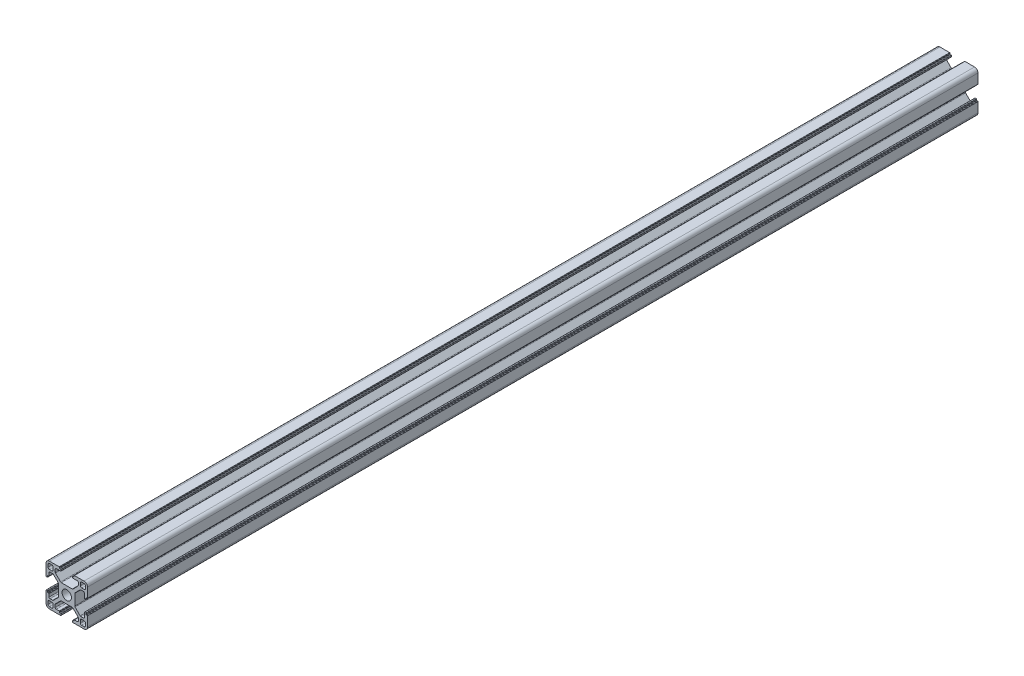
from build123d import *

# Parameters (mm, degrees)
SKETCH1_R           = 3.4
BOSS_EXTRUDE1_DEPTH = 644


with BuildPart() as part:
    # Sketch1 → Boss-Extrude1 (new body)
    with BuildSketch(Plane.XY):
        with BuildLine():
            Line((0, 2.5), (0, 10.6))
            ThreePointArc((0, 10.6), (0.058578644, 10.741421356), (0.2, 10.8))
            Line((0.2, 10.8), (1, 10.8))
            ThreePointArc((1, 10.8), (1.141421356, 10.741421356), (1.2, 10.6))
            Line((1.2, 10.6), (1.2, 9.9))
            ThreePointArc((1.2, 9.9), (1.258578644, 9.758578644), (1.4, 9.7))
            Line((1.4, 9.7), (2, 9.7))
            ThreePointArc((2, 9.7), (2.141421356, 9.641421356), (2.2, 9.5))
            Line((2.2, 9.5), (2.2, 7.4))
            ThreePointArc((2.2, 7.4), (2.419669914, 6.869669914), (2.95, 6.65))
            Line((2.95, 6.65), (4.78370491, 6.65))
            ThreePointArc((4.78370491, 6.65), (5.070717484, 6.707090351), (5.314034995, 6.869669914))
            Line((5.314034995, 6.869669914), (8.980330086, 10.535965005))
            ThreePointArc((8.980330086, 10.535965005), (9.142909649, 10.779282516), (9.2, 11.06629509))
            Line((9.2, 11.06629509), (9.2, 18.93370491))
            ThreePointArc((9.2, 18.93370491), (9.142909649, 19.220717484), (8.980330086, 19.464034995))
            Line((8.980330086, 19.464034995), (5.314034995, 23.130330086))
            ThreePointArc((5.314034995, 23.130330086), (5.070717484, 23.292909649), (4.78370491, 23.35))
            Line((4.78370491, 23.35), (2.95, 23.35))
            ThreePointArc((2.95, 23.35), (2.419669914, 23.130330086), (2.2, 22.6))
            Line((2.2, 22.6), (2.2, 20.5))
            ThreePointArc((2.2, 20.5), (2.141421356, 20.358578644), (2, 20.3))
            Line((2, 20.3), (1.4, 20.3))
            ThreePointArc((1.4, 20.3), (1.258578644, 20.241421356), (1.2, 20.1))
            Line((1.2, 20.1), (1.2, 19.4))
            ThreePointArc((1.2, 19.4), (1.141421356, 19.258578644), (1, 19.2))
            Line((1, 19.2), (0.2, 19.2))
            ThreePointArc((0.2, 19.2), (0.058578644, 19.258578644), (0, 19.4))
            Line((0, 19.4), (0, 27.5))
            ThreePointArc((0, 27.5), (0.732233047, 29.267766953), (2.5, 30))
            Line((2.5, 30), (9.5, 30))
            ThreePointArc((9.5, 30), (9.641421356, 29.941421356), (9.7, 29.8))
            Line((9.7, 29.8), (9.7, 29.2))
            ThreePointArc((9.7, 29.2), (9.758578644, 29.058578644), (9.9, 29))
            Line((9.9, 29), (10.6, 29))
            ThreePointArc((10.6, 29), (10.741421356, 28.941421356), (10.8, 28.8))
            Line((10.8, 28.8), (10.8, 28))
            ThreePointArc((10.8, 28), (10.741421356, 27.858578644), (10.6, 27.8))
            Line((10.6, 27.8), (7.4, 27.8))
            ThreePointArc((7.4, 27.8), (6.869669914, 27.580330086), (6.65, 27.05))
            Line((6.65, 27.05), (6.65, 25.21629509))
            ThreePointArc((6.65, 25.21629509), (6.707090351, 24.929282516), (6.869669914, 24.685965005))
            Line((6.869669914, 24.685965005), (10.535965005, 21.019669914))
            ThreePointArc((10.535965005, 21.019669914), (10.779282516, 20.857090351), (11.06629509, 20.8))
            Line((11.06629509, 20.8), (18.93370491, 20.8))
            ThreePointArc((18.93370491, 20.8), (19.220717484, 20.857090351), (19.464034995, 21.019669914))
            Line((19.464034995, 21.019669914), (23.130330086, 24.685965005))
            ThreePointArc((23.130330086, 24.685965005), (23.292909649, 24.929282516), (23.35, 25.21629509))
            Line((23.35, 25.21629509), (23.35, 27.05))
            ThreePointArc((23.35, 27.05), (23.130330086, 27.580330086), (22.6, 27.8))
            Line((22.6, 27.8), (19.4, 27.8))
            ThreePointArc((19.4, 27.8), (19.258578644, 27.858578644), (19.2, 28))
            Line((19.2, 28), (19.2, 28.8))
            ThreePointArc((19.2, 28.8), (19.258578644, 28.941421356), (19.4, 29))
            Line((19.4, 29), (20.1, 29))
            ThreePointArc((20.1, 29), (20.241421356, 29.058578644), (20.3, 29.2))
            Line((20.3, 29.2), (20.3, 29.8))
            ThreePointArc((20.3, 29.8), (20.358578644, 29.941421356), (20.5, 30))
            Line((20.5, 30), (27.5, 30))
            ThreePointArc((27.5, 30), (29.267766953, 29.267766953), (30, 27.5))
            Line((30, 27.5), (30, 20.5))
            ThreePointArc((30, 20.5), (29.941421356, 20.358578644), (29.8, 20.3))
            Line((29.8, 20.3), (29.2, 20.3))
            ThreePointArc((29.2, 20.3), (29.058578644, 20.241421356), (29, 20.1))
            Line((29, 20.1), (29, 19.4))
            ThreePointArc((29, 19.4), (28.941421356, 19.258578644), (28.8, 19.2))
            Line((28.8, 19.2), (28, 19.2))
            ThreePointArc((28, 19.2), (27.858578644, 19.258578644), (27.8, 19.4))
            Line((27.8, 19.4), (27.8, 22.6))
            ThreePointArc((27.8, 22.6), (27.580330086, 23.130330086), (27.05, 23.35))
            Line((27.05, 23.35), (25.21629509, 23.35))
            ThreePointArc((25.21629509, 23.35), (24.929282516, 23.292909649), (24.685965005, 23.130330086))
            Line((24.685965005, 23.130330086), (21.019669914, 19.464034995))
            ThreePointArc((21.019669914, 19.464034995), (20.857090351, 19.220717484), (20.8, 18.93370491))
            Line((20.8, 18.93370491), (20.8, 11.06629509))
            ThreePointArc((20.8, 11.06629509), (20.857090351, 10.779282516), (21.019669914, 10.535965005))
            Line((21.019669914, 10.535965005), (24.685965005, 6.869669914))
            ThreePointArc((24.685965005, 6.869669914), (24.929282516, 6.707090351), (25.21629509, 6.65))
            Line((25.21629509, 6.65), (27.05, 6.65))
            ThreePointArc((27.05, 6.65), (27.580330086, 6.869669914), (27.8, 7.4))
            Line((27.8, 7.4), (27.8, 10.6))
            ThreePointArc((27.8, 10.6), (27.858578644, 10.741421356), (28, 10.8))
            Line((28, 10.8), (28.8, 10.8))
            ThreePointArc((28.8, 10.8), (28.941421356, 10.741421356), (29, 10.6))
            Line((29, 10.6), (29, 9.9))
            ThreePointArc((29, 9.9), (29.058578644, 9.758578644), (29.2, 9.7))
            Line((29.2, 9.7), (29.8, 9.7))
            ThreePointArc((29.8, 9.7), (29.941421356, 9.641421356), (30, 9.5))
            Line((30, 9.5), (30, 2.5))
            ThreePointArc((30, 2.5), (29.267766953, 0.732233047), (27.5, 0))
            Line((27.5, 0), (19.4, 0))
            ThreePointArc((19.4, 0), (19.258578644, 0.058578644), (19.2, 0.2))
            Line((19.2, 0.2), (19.2, 1.132430858))
            ThreePointArc((19.2, 1.132430858), (19.258578644, 1.273852214), (19.4, 1.332430858))
            Line((19.4, 1.332430858), (20.1, 1.332430858))
            ThreePointArc((20.1, 1.332430858), (20.241421356, 1.391009502), (20.3, 1.532430858))
            Line((20.3, 1.532430858), (20.3, 2))
            ThreePointArc((20.3, 2), (20.358578644, 2.141421356), (20.5, 2.2))
            Line((20.5, 2.2), (22.6, 2.2))
            ThreePointArc((22.6, 2.2), (23.130330086, 2.419669914), (23.35, 2.95))
            Line((23.35, 2.95), (23.35, 4.916135768))
            ThreePointArc((23.35, 4.916135768), (23.292909649, 5.203148342), (23.130330086, 5.446465854))
            Line((23.130330086, 5.446465854), (19.464034995, 9.112760944))
            ThreePointArc((19.464034995, 9.112760944), (19.220717484, 9.275340508), (18.93370491, 9.332430858))
            Line((18.93370491, 9.332430858), (11.06629509, 9.332430858))
            ThreePointArc((11.06629509, 9.332430858), (10.779282516, 9.275340508), (10.535965005, 9.112760944))
            Line((10.535965005, 9.112760944), (6.869669914, 5.446465854))
            ThreePointArc((6.869669914, 5.446465854), (6.707090351, 5.203148342), (6.65, 4.916135768))
            Line((6.65, 4.916135768), (6.65, 3.082430858))
            ThreePointArc((6.65, 3.082430858), (6.869669914, 2.552100772), (7.4, 2.332430858))
            Line((7.4, 2.332430858), (9.5, 2.332430858))
            ThreePointArc((9.5, 2.332430858), (9.641421356, 2.273852214), (9.7, 2.132430858))
            Line((9.7, 2.132430858), (9.7, 1.532430858))
            ThreePointArc((9.7, 1.532430858), (9.758578644, 1.391009502), (9.9, 1.332430858))
            Line((9.9, 1.332430858), (10.6, 1.332430858))
            ThreePointArc((10.6, 1.332430858), (10.741421356, 1.273852214), (10.8, 1.132430858))
            Line((10.8, 1.132430858), (10.8, 0.2))
            ThreePointArc((10.8, 0.2), (10.741421356, 0.058578644), (10.6, 0))
            Line((10.6, 0), (2.5, 0))
            ThreePointArc((2.5, 0), (0.732233047, 0.732233047), (0, 2.5))
        make_face()
        with Locations((15, 15)):
            Circle(SKETCH1_R, mode=Mode.SUBTRACT)
        with BuildLine():
            Line((27.55, 1.45), (25.8, 1.45))
            ThreePointArc((25.8, 1.45), (25.092893219, 1.742893219), (24.8, 2.45))
            Line((24.8, 2.45), (24.8, 4.2))
            ThreePointArc((24.8, 4.2), (25.092893219, 4.907106781), (25.8, 5.2))
            Line((25.8, 5.2), (27.55, 5.2))
            ThreePointArc((27.55, 5.2), (28.257106781, 4.907106781), (28.55, 4.2))
            Line((28.55, 4.2), (28.55, 2.45))
            ThreePointArc((28.55, 2.45), (28.257106781, 1.742893219), (27.55, 1.45))
        make_face(mode=Mode.SUBTRACT)
        with BuildLine():
            Line((24.8, 25.8), (24.8, 27.55))
            ThreePointArc((24.8, 27.55), (25.092893219, 28.257106781), (25.8, 28.55))
            Line((25.8, 28.55), (27.55, 28.55))
            ThreePointArc((27.55, 28.55), (28.257106781, 28.257106781), (28.55, 27.55))
            Line((28.55, 27.55), (28.55, 25.8))
            ThreePointArc((28.55, 25.8), (28.257106781, 25.092893219), (27.55, 24.8))
            Line((27.55, 24.8), (25.8, 24.8))
            ThreePointArc((25.8, 24.8), (25.092893219, 25.092893219), (24.8, 25.8))
        make_face(mode=Mode.SUBTRACT)
        with BuildLine():
            Line((2.45, 28.55), (4.2, 28.55))
            ThreePointArc((4.2, 28.55), (4.907106781, 28.257106781), (5.2, 27.55))
            Line((5.2, 27.55), (5.2, 25.8))
            ThreePointArc((5.2, 25.8), (4.907106781, 25.092893219), (4.2, 24.8))
            Line((4.2, 24.8), (2.45, 24.8))
            ThreePointArc((2.45, 24.8), (1.742893219, 25.092893219), (1.45, 25.8))
            Line((1.45, 25.8), (1.45, 27.55))
            ThreePointArc((1.45, 27.55), (1.742893219, 28.257106781), (2.45, 28.55))
        make_face(mode=Mode.SUBTRACT)
        with BuildLine():
            Line((1.45, 2.45), (1.45, 4.2))
            ThreePointArc((1.45, 4.2), (1.742893219, 4.907106781), (2.45, 5.2))
            Line((2.45, 5.2), (4.2, 5.2))
            ThreePointArc((4.2, 5.2), (4.907106781, 4.907106781), (5.2, 4.2))
            Line((5.2, 4.2), (5.2, 2.45))
            ThreePointArc((5.2, 2.45), (4.907106781, 1.742893219), (4.2, 1.45))
            Line((4.2, 1.45), (2.45, 1.45))
            ThreePointArc((2.45, 1.45), (1.742893219, 1.742893219), (1.45, 2.45))
        make_face(mode=Mode.SUBTRACT)
    extrude(amount=BOSS_EXTRUDE1_DEPTH)


solid = part.part
